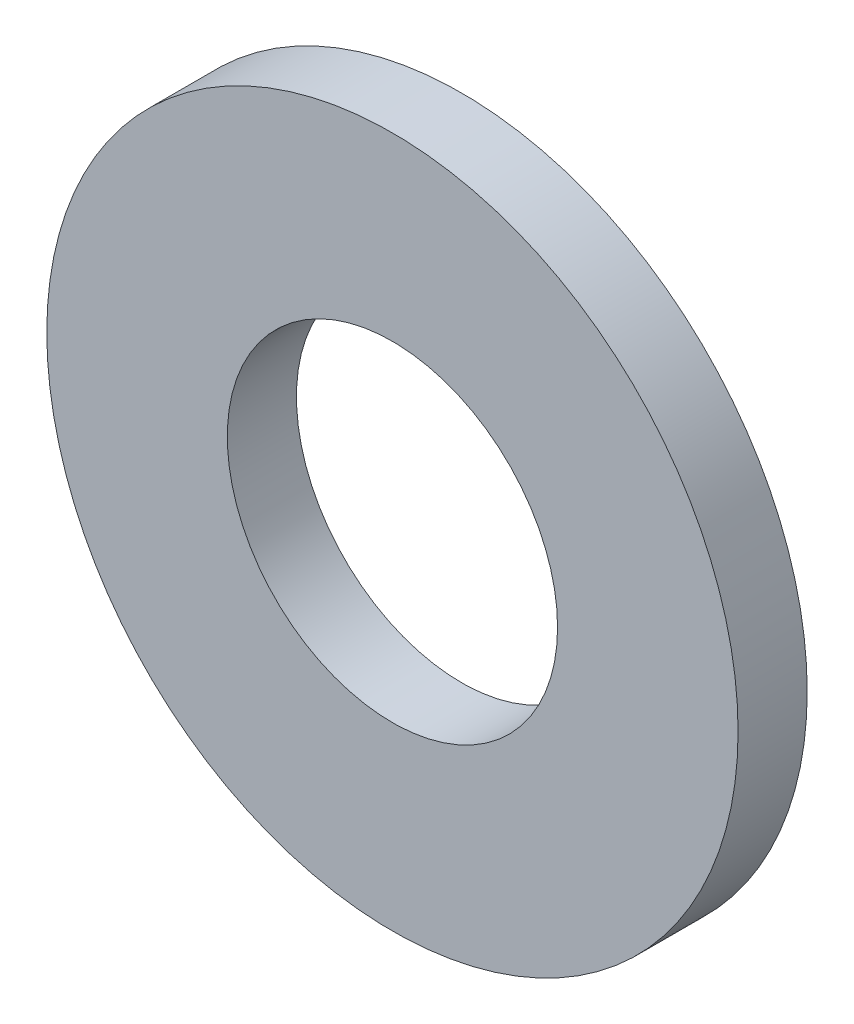
from build123d import *

# Parameters (mm, degrees)
SKETCH_1_R      = 4.5
SKETCH_1_R_2    = 2.15
EXTRUDE_1_DEPTH = 0.9


with BuildPart() as part:
    # 草图1 → 凸台-拉伸1 (new body)
    with BuildSketch(Plane.XY):
        Circle(SKETCH_1_R)
        Circle(SKETCH_1_R_2, mode=Mode.SUBTRACT)
    extrude(amount=EXTRUDE_1_DEPTH)


solid = part.part
